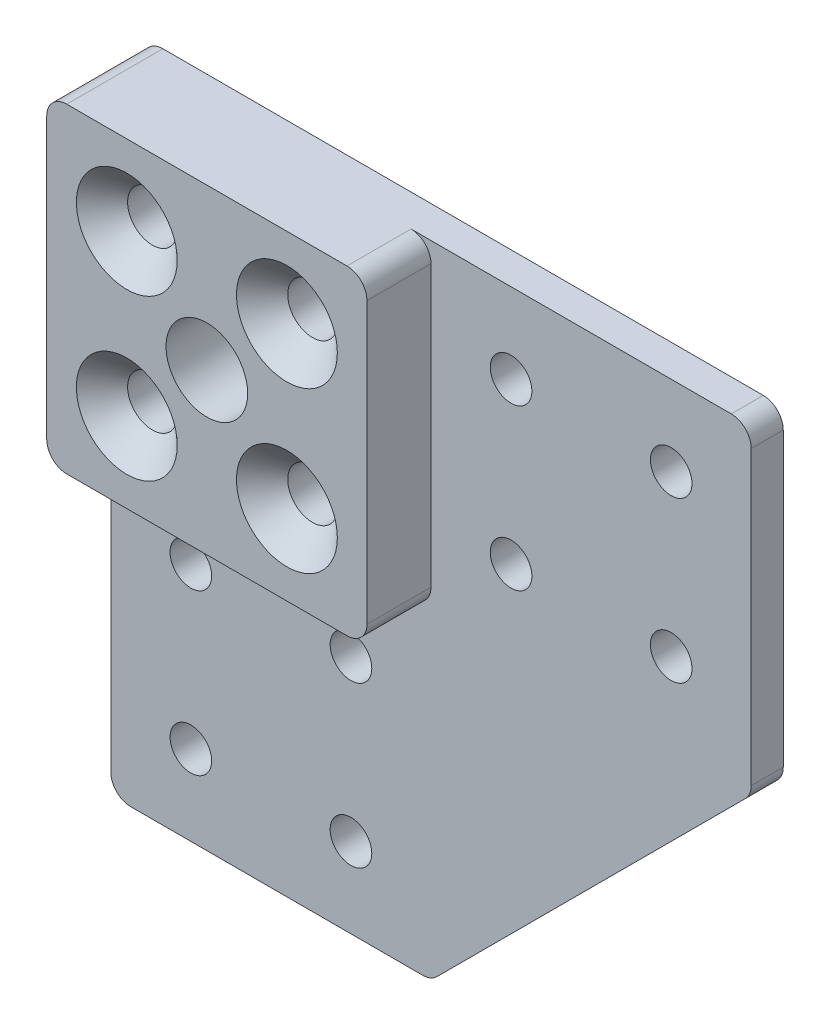
from build123d import *

# Parameters (mm, degrees)
EXTRUDE_1_DEPTH             = 4
SKETCH_2_W                  = 40
SKETCH_2_H                  = 40
EXTRUDE_2_DEPTH             = 8
HOLE_WIZARD_M61_D           = 6.2
HOLE_WIZARD_M61_CSINK_D     = 12.6
HOLE_WIZARD_M61_CSINK_ANGLE = 90
SKETCH_5_R                  = 5.1
CUT_EXTRUDE_1_DEPTH         = 114.771701227
SKETCH_6_R                  = 2.6
CUT_EXTRUDE_2_DEPTH         = 114.41957503
FILLET_1_R                  = 2.5


with BuildPart() as part:
    # Эскиз1 → Бобышка-Вытянуть1 (new body)
    with BuildSketch(Plane.XY):
        Polygon((0, 0), (80, 0), (80, -40), (40, -80), (0, -80), align=None)
    extrude(amount=EXTRUDE_1_DEPTH)

    # Эскиз2 → Бобышка-Вытянуть2 (add)
    with BuildSketch(Plane.XY.offset(4)):
        with Locations((20, -20)):
            Rectangle(SKETCH_2_W, SKETCH_2_H)
    extrude(amount=EXTRUDE_2_DEPTH)

    # Зенковка для винта с полупотайной головкой M61 (through all)
    with Locations(Plane(origin=(10, -30, 12), x_dir=(1, 0, 0), z_dir=(0, 0, 1))):
        with Locations((0, 0), (0, 20), (20, 20), (20, 0)):
            CounterSinkHole(HOLE_WIZARD_M61_D / 2, HOLE_WIZARD_M61_CSINK_D / 2, counter_sink_angle=HOLE_WIZARD_M61_CSINK_ANGLE)

    # Эскиз5 → Вырез-Вытянуть1 (cut, through all)
    with BuildSketch(Plane.XY.offset(12)):
        with Locations((20, -20)):
            Circle(SKETCH_5_R)
    extrude(amount=-CUT_EXTRUDE_1_DEPTH, mode=Mode.SUBTRACT)

    # Эскиз6 → Вырез-Вытянуть2 (cut, through all)
    with BuildSketch(Plane.XY.offset(4)):
        with Locations((10, -50)):
            Circle(SKETCH_6_R)
        with Locations((30, -50)):
            Circle(SKETCH_6_R)
        with Locations((30, -70)):
            Circle(SKETCH_6_R)
        with Locations((10, -70)):
            Circle(SKETCH_6_R)
        with Locations(Location((70, -10, 0), (0, 0, 180))):
            Circle(SKETCH_6_R)
        with Locations(Location((70, -30, 0), (0, 0, 180))):
            Circle(SKETCH_6_R)
        with Locations(Location((50, -30, 0), (0, 0, 180))):
            Circle(SKETCH_6_R)
        with Locations(Location((50, -10, 0), (0, 0, 180))):
            Circle(SKETCH_6_R)
    extrude(amount=-CUT_EXTRUDE_2_DEPTH, mode=Mode.SUBTRACT)

    # Скругление1
    fillet_1_edges = [part.edges().sort_by_distance(p)[0] for p in [
        (0, -40, 8),
        (40, -40, 8),
        (40, 0, 8),
        (0, 0, 6),
        (80, 0, 2),
        (80, -40, 2),
        (40, -80, 2),
        (0, -80, 2),
    ]]
    fillet(fillet_1_edges, radius=FILLET_1_R)


solid = part.part
